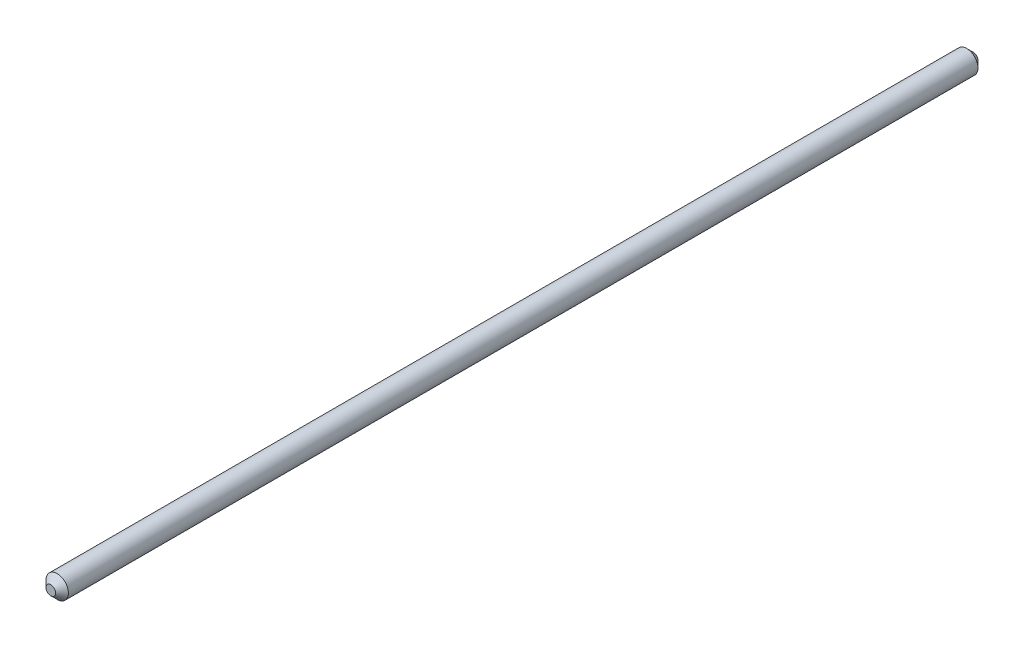
from build123d import *

# Parameters (mm, degrees)
SKETCH2_W     = 325
SKETCH2_H     = 3.95
CHAMFER1_SIZE = 2.25


with BuildPart() as part:
    # Sketch2 → Revolve1 (revolve)
    with BuildSketch(Plane(origin=(0, 0, 0), x_dir=(0, 0, -1), z_dir=(1, 0, 0)), mode=Mode.PRIVATE) as revolve1_sk:
        with Locations((0, 1.975)):
            Rectangle(SKETCH2_W, SKETCH2_H)
    revolve(revolve1_sk.sketch.rotate(Axis((0, 0, 162.5), (0, 0, -1)), 90), axis=Axis((0, 0, 162.5), (0, 0, -1)))

    # Chamfer1
    chamfer1_edges = [part.edges().sort_by_distance(p)[0] for p in [
        (-3.95, 0, -162.5),
        (-3.95, 0, 162.5),
    ]]
    chamfer(chamfer1_edges, length=CHAMFER1_SIZE)


solid = part.part
